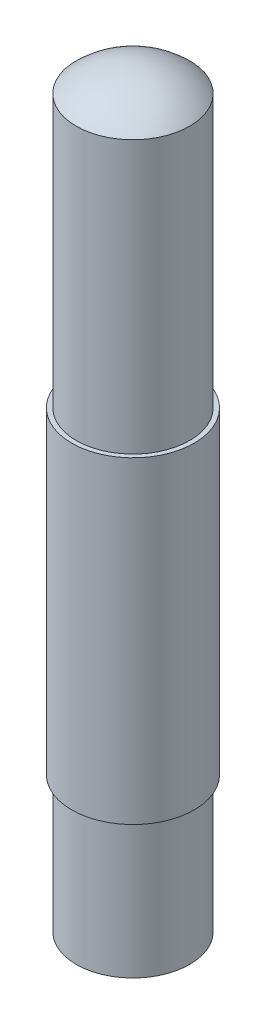
from build123d import *

# Parameters (mm, degrees)
KUBBE1_FACE_RADIUS = 12.5
KUBBE1_HEIGHT      = 5


with BuildPart() as part:
    # Çizim1 → Döndür2 (revolve)
    with BuildSketch(Plane.XY, mode=Mode.PRIVATE) as d_nd_r2_sk:
        Polygon((0, 0), (-12.5, 0), (-12.5, 30), (-13.5, 30), (-13.5, 100), (-12.5, 100), (-12.5, 160), (0, 160), align=None)
    revolve(d_nd_r2_sk.sketch.rotate(Axis((0, 160, 0), (0, -1, 0)), 270), axis=Axis((0, 160, 0), (0, -1, 0)))

    # Kubbe1: a dome of height H over a round flat face of radius A is a cap of a sphere of radius (A * A + H * H) / (2 * H)
    kubbe1_r = (KUBBE1_FACE_RADIUS * KUBBE1_FACE_RADIUS + KUBBE1_HEIGHT * KUBBE1_HEIGHT) / (2 * KUBBE1_HEIGHT)
    kubbe1_base = Plane((0, 160, 0), z_dir=(0, 1, 0))
    with Locations(kubbe1_base.offset(KUBBE1_HEIGHT - kubbe1_r)):
        kubbe1_ball = Sphere(kubbe1_r, mode=Mode.PRIVATE)
    add(split(kubbe1_ball, bisect_by=kubbe1_base, keep=Keep.TOP, mode=Mode.PRIVATE))


solid = part.part
